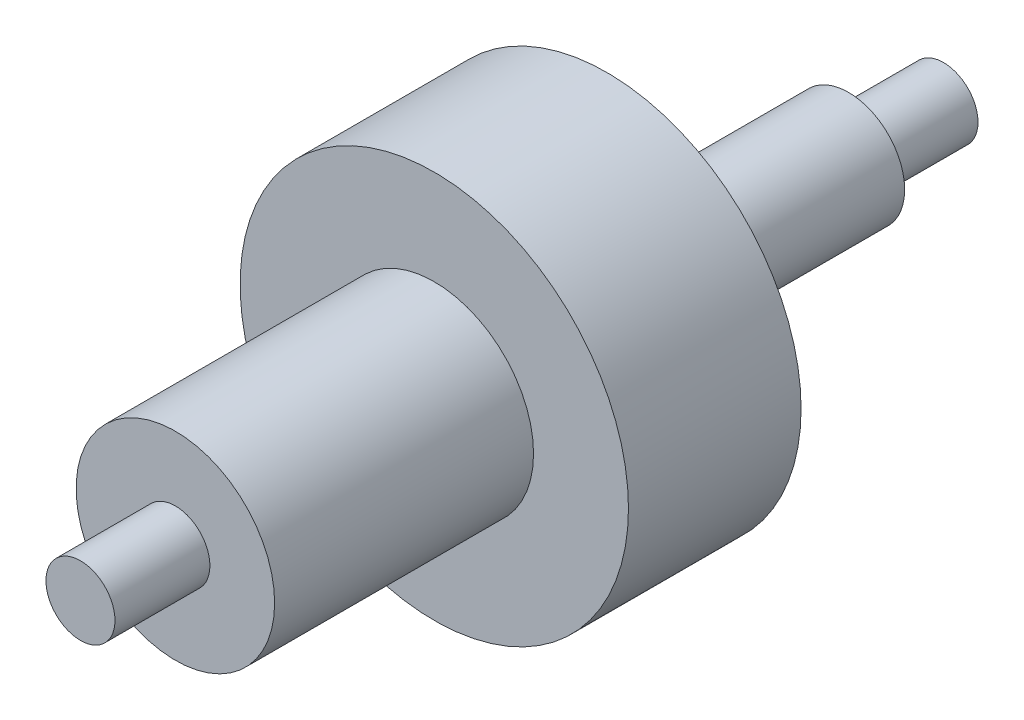
from build123d import *

# Parameters (mm, degrees)
SKETCH1_R           = 0.4
BOSS_EXTRUDE1_DEPTH = 1.1
SKETCH2_R           = 0.65
BOSS_EXTRUDE2_DEPTH = 2.8
SKETCH3_R           = 2.25
BOSS_EXTRUDE3_DEPTH = 2
SKETCH4_R           = 1.15
BOSS_EXTRUDE4_DEPTH = 3
SKETCH5_R           = 0.4
BOSS_EXTRUDE5_DEPTH = 1.1


with BuildPart() as part:
    # Sketch1 → Boss-Extrude1 (new body)
    with BuildSketch(Plane.XY):
        Circle(SKETCH1_R)
    extrude(amount=BOSS_EXTRUDE1_DEPTH)

    # Sketch2 → Boss-Extrude2 (add)
    with BuildSketch(Plane.XY.offset(1.1)):
        Circle(SKETCH2_R)
    extrude(amount=BOSS_EXTRUDE2_DEPTH)

    # Sketch3 → Boss-Extrude3 (add)
    with BuildSketch(Plane.XY.offset(3.9)):
        Circle(SKETCH3_R)
    extrude(amount=BOSS_EXTRUDE3_DEPTH)

    # Sketch4 → Boss-Extrude4 (add)
    with BuildSketch(Plane.XY.offset(5.9)):
        Circle(SKETCH4_R)
    extrude(amount=BOSS_EXTRUDE4_DEPTH)

    # Sketch5 → Boss-Extrude5 (add)
    with BuildSketch(Plane.XY.offset(8.9)):
        Circle(SKETCH5_R)
    extrude(amount=BOSS_EXTRUDE5_DEPTH)


solid = part.part
